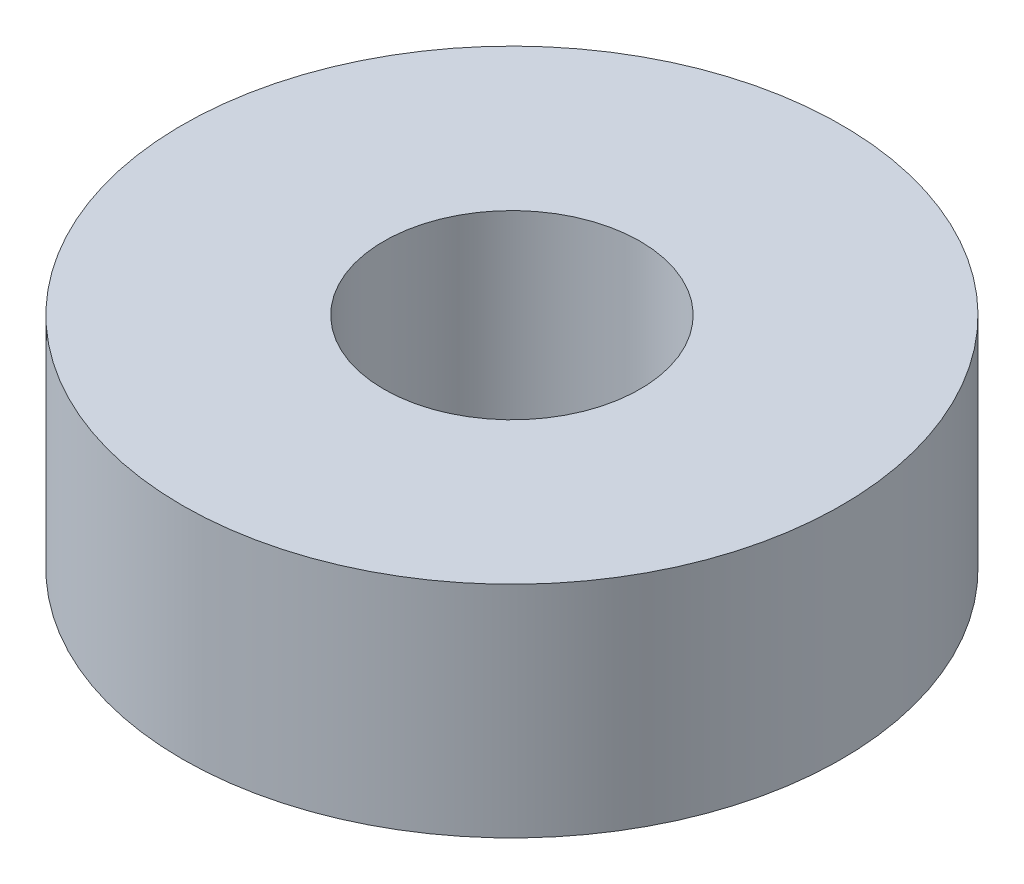
from build123d import *

# Parameters (mm, degrees)
SKETCH_1_R      = 9
SKETCH_1_R_2    = 3.5
EXTRUDE_1_DEPTH = 6


with BuildPart() as part:
    # Эскиз1 → Вытянуть1 (new body)
    with BuildSketch(Plane(origin=(0, 0, 0), x_dir=(1, 0, 0), z_dir=(0, 1, 0))):
        with Locations(Location((0, -2.293695016, 0), (0, 0, 270))):
            Circle(SKETCH_1_R)
        with Locations(Location((0, -2.293695016, 0), (0, 0, 270))):
            Circle(SKETCH_1_R_2, mode=Mode.SUBTRACT)
    extrude(amount=EXTRUDE_1_DEPTH)


solid = part.part
